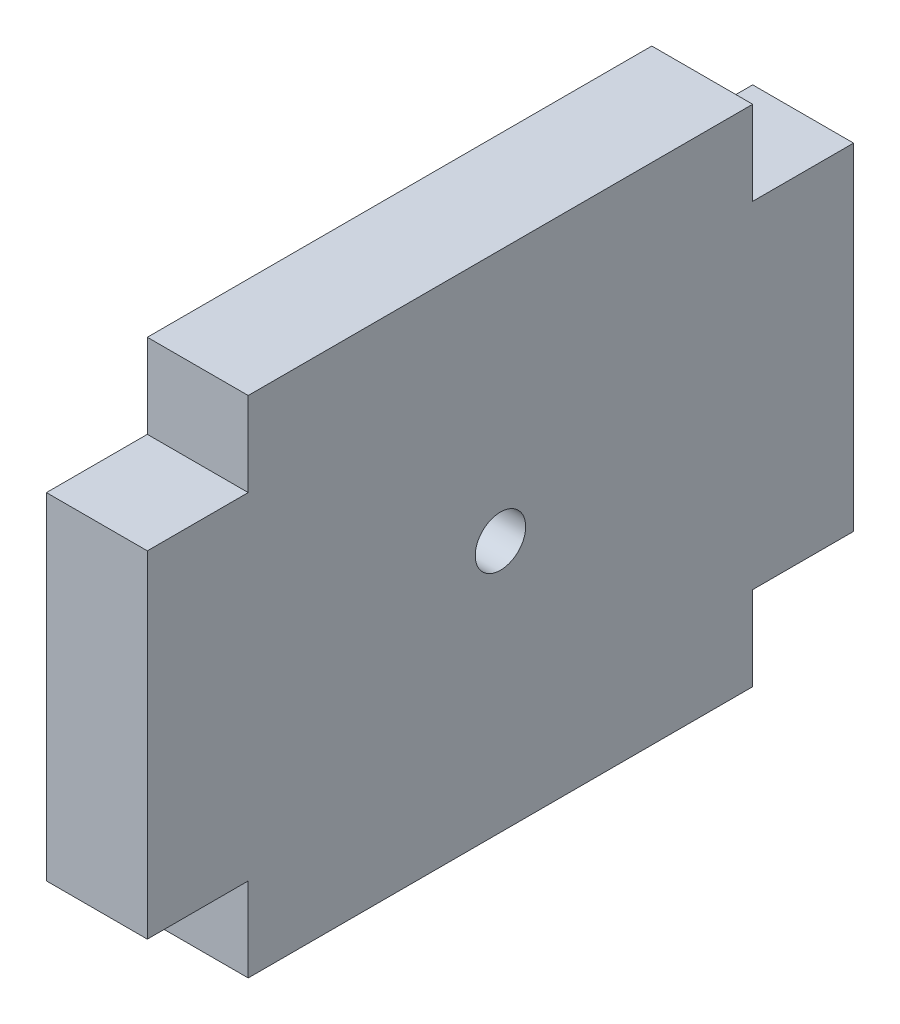
from build123d import *

# Parameters (mm, degrees)
SKICA1_W                 = 3
SKICA1_H                 = 10
SKICA1_W_2               = 15
SKICA1_H_2               = 15
P_IDAT_VYSUNUT_M1_DEPTH  = 3
SKICA2_R                 = 0.75
ODEBRAT_VYSUNUT_M1_DEPTH = 3


with BuildPart() as part:
    # Skica1 → Přidat vysunutím1 (new body)
    with BuildSketch(Plane(origin=(0, 0, 0), x_dir=(0, 0, -1), z_dir=(1, 0, 0))):
        with Locations((9, 0)):
            Rectangle(SKICA1_W, SKICA1_H)
        Rectangle(SKICA1_W_2, SKICA1_H_2)
        with Locations((-9, 0)):
            Rectangle(SKICA1_W, SKICA1_H)
    extrude(amount=P_IDAT_VYSUNUT_M1_DEPTH)

    # Skica2 → Odebrat vysunutím1 (cut)
    with BuildSketch(Plane(origin=(3, 0, 0), x_dir=(0, 0, -1), z_dir=(1, 0, 0))):
        Circle(SKICA2_R)
    extrude(amount=-ODEBRAT_VYSUNUT_M1_DEPTH, mode=Mode.SUBTRACT)


solid = part.part
